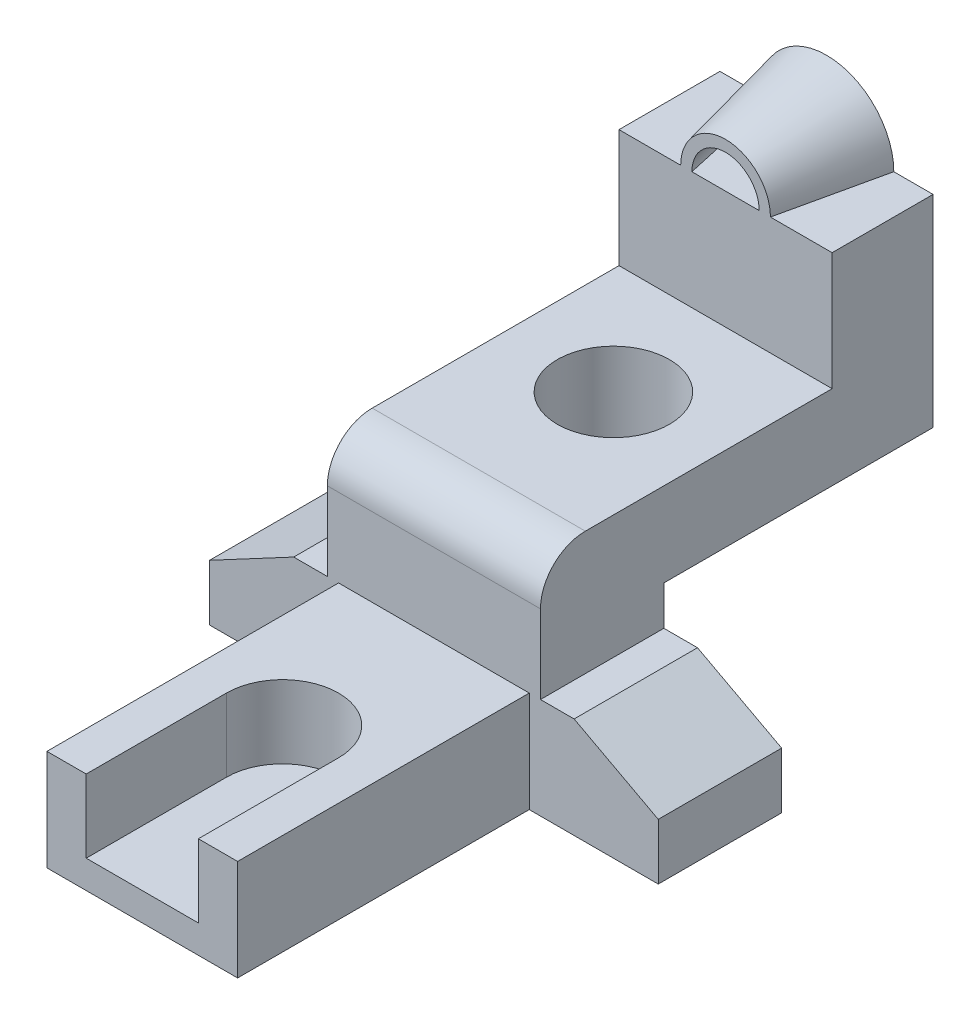
from build123d import *

# Parameters (mm, degrees)
BOSS_EXTRUDE1_DEPTH = 40
SKETCH2_W           = 21
SKETCH2_H           = 43
CUT_EXTRUDE1_DEPTH  = 80
CUT_EXTRUDE2_DEPTH  = 80
SKETCH4_W           = 34
SKETCH4_H           = 18
BOSS_EXTRUDE3_DEPTH = 52
CUT_EXTRUDE3_DEPTH  = 13
HOLE1_D             = 20
FILLET1_R           = 8


with BuildPart() as part:
    # Sketch1 → Boss-Extrude1 (new, symmetric)
    with BuildSketch(Plane(origin=(0, 0, 0), x_dir=(0, 0, -1), z_dir=(1, 0, 0))):
        Polygon((0, 0), (0, 40), (52, 40), (52, 61), (70, 61), (70, 25), (22, 25), (22, 0), align=None)
    extrude(amount=BOSS_EXTRUDE1_DEPTH, both=True)

    # Sketch2 → Cut-Extrude1 (cut)
    with BuildSketch(Plane.XY):
        with Locations((-29.5, 39.5)):
            Rectangle(SKETCH2_W, SKETCH2_H)
        with Locations((29.5, 39.5)):
            Rectangle(SKETCH2_W, SKETCH2_H)
    extrude(amount=-CUT_EXTRUDE1_DEPTH, mode=Mode.SUBTRACT)

    # Sketch3 → Cut-Extrude2 (cut)
    with BuildSketch(Plane.XY):
        Polygon((25, 18), (40, 10), (40, 18), align=None)
    cut_extrude2 = extrude(amount=-CUT_EXTRUDE2_DEPTH, mode=Mode.SUBTRACT)

    # Mirror1: Cut-Extrude2 across plane
    add(cut_extrude2.mirror(Plane(origin=(0, 0, 0), x_dir=(0, 0, 1), z_dir=(1, 0, 0))), mode=Mode.SUBTRACT)

    # Sketch4 → Boss-Extrude3 (add)
    with BuildSketch(Plane.XY):
        with Locations((0, 9)):
            Rectangle(SKETCH4_W, SKETCH4_H)
    extrude(amount=BOSS_EXTRUDE3_DEPTH)

    # Sketch5 → Cut-Extrude3 (cut)
    with BuildSketch(Plane(origin=(0, 18, 0), x_dir=(1, 0, 0), z_dir=(0, 1, 0))):
        with BuildLine():
            Line((-10, -27), (-10, -52))
            Line((-10, -52), (10, -52))
            Line((10, -52), (10, -27))
            ThreePointArc((10, -27), (0, -17), (-10, -27))
        make_face()
    extrude(amount=-CUT_EXTRUDE3_DEPTH, mode=Mode.SUBTRACT)

    # Sketch6 → Revolve1 (revolve)
    with BuildSketch(Plane(origin=(0, 61, 0), x_dir=(1, 0, 0), z_dir=(0, 1, 0))):
        Polygon((6, 52), (10, 70), (12, 70), (8, 52), align=None)
    revolve(axis=Axis((0, 61, 0), (0, 0, -1)))

    # Hole1 (through all)
    with Locations(Plane(origin=(0, 40, 0), x_dir=(1, 0, 0), z_dir=(0, 1, 0))):
        with Locations((0, 32)):
            Hole(HOLE1_D / 2)

    # Fillet1
    fillet1_edges = [part.edges().sort_by_distance(p)[0] for p in [
        (0, 40, 0),
    ]]
    fillet(fillet1_edges, radius=FILLET1_R)


solid = part.part
